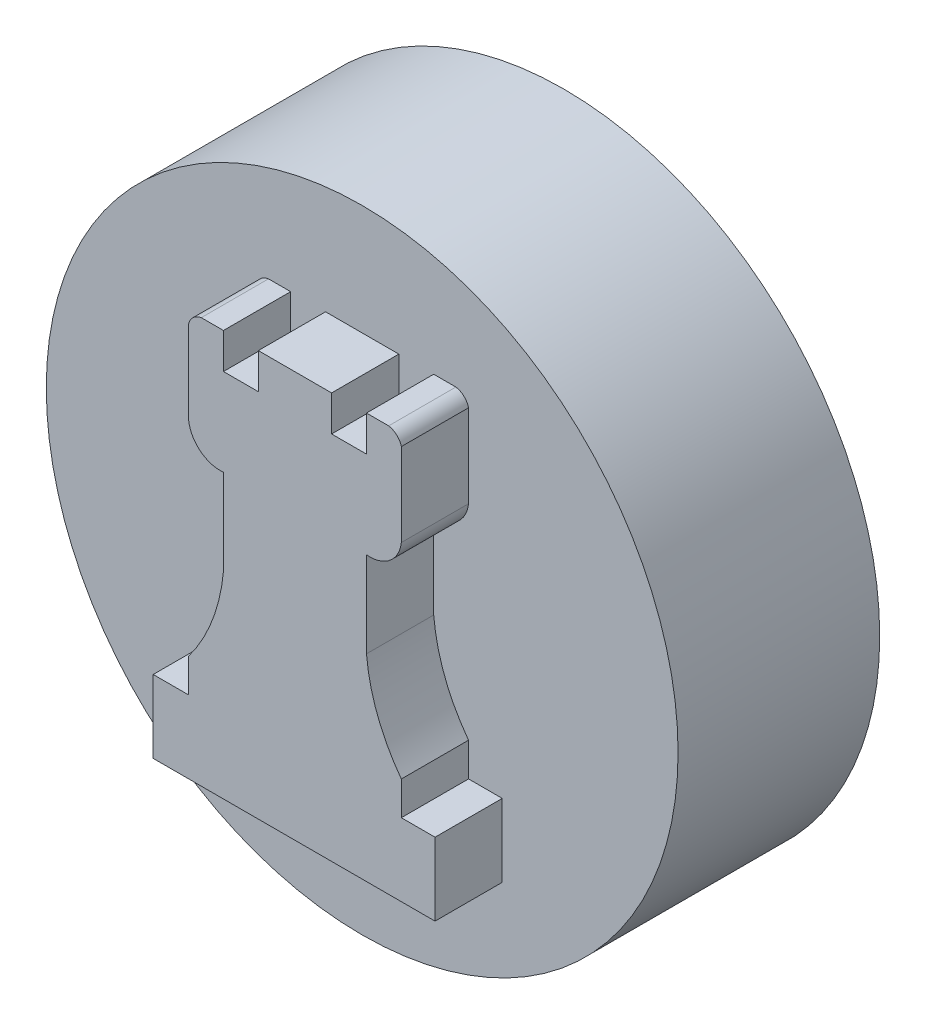
from build123d import *

# Parameters (mm, degrees)
SKETCH1_R           = 11.938
SKETCH1_R_2         = 8.763
BOSS_EXTRUDE1_DEPTH = 5.08
SKETCH2_R           = 11.938
BOSS_EXTRUDE2_DEPTH = 2.54
BOSS_EXTRUDE8_DEPTH = 2.54


with BuildPart() as part:
    # Sketch1 → Boss-Extrude1 (new body)
    with BuildSketch(Plane.XY):
        Circle(SKETCH1_R)
        Circle(SKETCH1_R_2, mode=Mode.SUBTRACT)
    extrude(amount=BOSS_EXTRUDE1_DEPTH)

    # Sketch2 → Boss-Extrude2 (add)
    with BuildSketch(Plane.XY.offset(5.08)):
        Circle(SKETCH2_R)
    extrude(amount=BOSS_EXTRUDE2_DEPTH)

    # Sketch3 → Boss-Extrude8 (add)
    with BuildSketch(Plane.XY.offset(7.62)):
        with BuildLine():
            Line((1.384866851, 7.764949028), (-1.384866851, 7.764949028))
            Line((-1.384866851, 7.764949028), (-1.384866851, 6.420894347))
            Line((-1.384866851, 6.420894347), (-2.702727896, 6.420894347))
            Line((-2.702727896, 6.420894347), (-2.702727896, 7.764949028))
            Line((-2.702727896, 7.764949028), (-3.54067733, 7.764949028))
            ThreePointArc((-3.54067733, 7.764949028), (-3.845533247, 7.616635469), (-4.019746325, 7.325802449))
            Line((-4.019746325, 7.325802449), (-4.019746325, 4.185239036))
            ThreePointArc((-4.019746325, 4.185239036), (-3.580344494, 3.383503573), (-2.702727896, 3.127295005))
            Line((-2.702727896, 3.127295005), (-2.702727896, -0.115652291))
            ThreePointArc((-2.702727896, -0.115652291), (-3.121575281, -1.926106842), (-4.019746325, -3.552903568))
            Line((-4.019746325, -3.552903568), (-4.019746325, -4.820747752))
            Line((-4.019746325, -4.820747752), (-5.357231947, -4.820747752))
            Line((-5.357231947, -4.820747752), (-5.357231947, -7.568020311))
            Line((-5.357231947, -7.568020311), (5.293156983, -7.568020311))
            Line((5.293156983, -7.568020311), (5.293156983, -4.820747752))
            Line((5.293156983, -4.820747752), (4.019746325, -4.820747752))
            Line((4.019746325, -4.820747752), (4.019746325, -3.552903568))
            ThreePointArc((4.019746325, -3.552903568), (3.121575281, -1.926106842), (2.702727896, -0.115652291))
            Line((2.702727896, -0.115652291), (2.702727896, 3.127295005))
            ThreePointArc((2.702727896, 3.127295005), (3.580344494, 3.383503573), (4.019746325, 4.185239036))
            Line((4.019746325, 4.185239036), (4.019746325, 7.325802449))
            ThreePointArc((4.019746325, 7.325802449), (3.845533247, 7.616635469), (3.54067733, 7.764949028))
            Line((3.54067733, 7.764949028), (2.702727896, 7.764949028))
            Line((2.702727896, 7.764949028), (2.702727896, 6.420894347))
            Line((2.702727896, 6.420894347), (1.384866851, 6.420894347))
            Line((1.384866851, 6.420894347), (1.384866851, 7.764949028))
        make_face()
    extrude(amount=BOSS_EXTRUDE8_DEPTH)


solid = part.part
